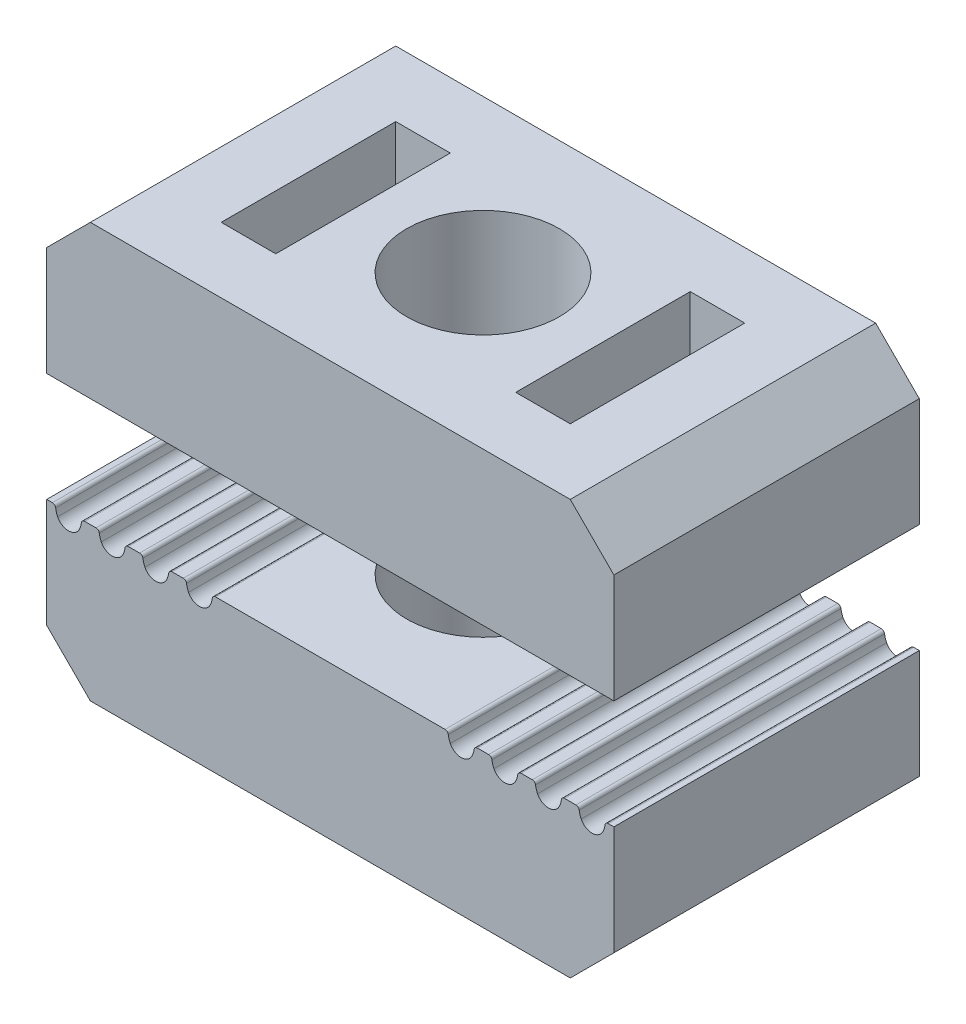
from build123d import *

# Parameters (mm, degrees)
SALIENTE_EXTRUIR1_DEPTH   = 14
SALIENTE_EXTRUIR1_2_DEPTH = 14
CROQUIS2_R                = 3.5
CORTAR_EXTRUIR1_DEPTH     = 27.944387171
CROQUIS3_W                = 2.5
CROQUIS3_H                = 8
CORTAR_EXTRUIR2_DEPTH     = 7
REDONDEO1_R               = 1


with BuildPart() as part:
    # Croquis1 → Saliente-Extruir1 (new body)
    with BuildSketch(Plane.XY):
        with BuildLine():
            Line((7.259824575, 7), (6.740175425, 7))
            ThreePointArc((6.740175425, 7), (6.641268354, 6.962771412), (6.591456891, 6.869565217))
            ThreePointArc((6.591456891, 6.869565217), (6.557611714, 6.711937846), (6.498876404, 6.561797753))
            ThreePointArc((6.498876404, 6.561797753), (6, 6.25), (5.501123596, 6.561797753))
            ThreePointArc((5.501123596, 6.561797753), (5.442388286, 6.711937846), (5.408543109, 6.869565217))
            ThreePointArc((5.408543109, 6.869565217), (5.358731646, 6.962771412), (5.259824575, 7))
            Line((5.259824575, 7), (5, 7))
            Line((5, 7), (-5, 7))
            Line((-5, 7), (-5.259824575, 7))
            ThreePointArc((-5.259824575, 7), (-5.358731646, 6.962771412), (-5.408543109, 6.869565217))
            ThreePointArc((-5.408543109, 6.869565217), (-5.442388286, 6.711937846), (-5.501123596, 6.561797753))
            ThreePointArc((-5.501123596, 6.561797753), (-6, 6.25), (-6.498876404, 6.561797753))
            ThreePointArc((-6.498876404, 6.561797753), (-6.557611714, 6.711937846), (-6.591456891, 6.869565217))
            ThreePointArc((-6.591456891, 6.869565217), (-6.641268354, 6.962771412), (-6.740175425, 7))
            Line((-6.740175425, 7), (-7.259824575, 7))
            ThreePointArc((-7.259824575, 7), (-7.358731646, 6.962771412), (-7.408543109, 6.869565217))
            ThreePointArc((-7.408543109, 6.869565217), (-7.442388286, 6.711937846), (-7.501123596, 6.561797753))
            ThreePointArc((-7.501123596, 6.561797753), (-8, 6.25), (-8.498876404, 6.561797753))
            ThreePointArc((-8.498876404, 6.561797753), (-8.557611714, 6.711937846), (-8.591456891, 6.869565217))
            ThreePointArc((-8.591456891, 6.869565217), (-8.641268354, 6.962771412), (-8.740175425, 7))
            Line((-8.740175425, 7), (-9, 7))
            Line((-9, 7), (-9.259824575, 7))
            ThreePointArc((-9.259824575, 7), (-9.358731646, 6.962771412), (-9.408543109, 6.869565217))
            ThreePointArc((-9.408543109, 6.869565217), (-9.442388286, 6.711937846), (-9.501123596, 6.561797753))
            ThreePointArc((-9.501123596, 6.561797753), (-10, 6.25), (-10.498876404, 6.561797753))
            ThreePointArc((-10.498876404, 6.561797753), (-10.557611714, 6.711937846), (-10.591456891, 6.869565217))
            ThreePointArc((-10.591456891, 6.869565217), (-10.641268354, 6.962771412), (-10.740175425, 7))
            Line((-10.740175425, 7), (-11.259824575, 7))
            ThreePointArc((-11.259824575, 7), (-11.358731646, 6.962771412), (-11.408543109, 6.869565217))
            ThreePointArc((-11.408543109, 6.869565217), (-11.442388286, 6.711937846), (-11.501123596, 6.561797753))
            ThreePointArc((-11.501123596, 6.561797753), (-12, 6.25), (-12.498876404, 6.561797753))
            ThreePointArc((-12.498876404, 6.561797753), (-12.557611714, 6.711937846), (-12.591456891, 6.869565217))
            ThreePointArc((-12.591456891, 6.869565217), (-12.641268354, 6.962771412), (-12.740175425, 7))
            Line((-12.740175425, 7), (-13, 7))
            Line((-13, 7), (-13, 2))
            Line((-13, 2), (-11, 0))
            Line((-11, 0), (11, 0))
            Line((11, 0), (13, 2))
            Line((13, 2), (13, 7))
            Line((13, 7), (12.740175425, 7))
            ThreePointArc((12.740175425, 7), (12.641268354, 6.962771412), (12.591456891, 6.869565217))
            ThreePointArc((12.591456891, 6.869565217), (12.557611714, 6.711937846), (12.498876404, 6.561797753))
            ThreePointArc((12.498876404, 6.561797753), (12, 6.25), (11.501123596, 6.561797753))
            ThreePointArc((11.501123596, 6.561797753), (11.442388286, 6.711937846), (11.408543109, 6.869565217))
            ThreePointArc((11.408543109, 6.869565217), (11.358731646, 6.962771412), (11.259824575, 7))
            Line((11.259824575, 7), (10.740175425, 7))
            ThreePointArc((10.740175425, 7), (10.641268354, 6.962771412), (10.591456891, 6.869565217))
            ThreePointArc((10.591456891, 6.869565217), (10.557611714, 6.711937846), (10.498876404, 6.561797753))
            ThreePointArc((10.498876404, 6.561797753), (10, 6.25), (9.501123596, 6.561797753))
            ThreePointArc((9.501123596, 6.561797753), (9.442388286, 6.711937846), (9.408543109, 6.869565217))
            ThreePointArc((9.408543109, 6.869565217), (9.358731646, 6.962771412), (9.259824575, 7))
            Line((9.259824575, 7), (9, 7))
            Line((9, 7), (8.740175425, 7))
            ThreePointArc((8.740175425, 7), (8.641268354, 6.962771412), (8.591456891, 6.869565217))
            ThreePointArc((8.591456891, 6.869565217), (8.557611714, 6.711937846), (8.498876404, 6.561797753))
            ThreePointArc((8.498876404, 6.561797753), (8, 6.25), (7.501123596, 6.561797753))
            ThreePointArc((7.501123596, 6.561797753), (7.442388286, 6.711937846), (7.408543109, 6.869565217))
            ThreePointArc((7.408543109, 6.869565217), (7.358731646, 6.962771412), (7.259824575, 7))
        make_face()
    extrude(amount=SALIENTE_EXTRUIR1_DEPTH)


with BuildPart() as body_2:
    # Croquis1 → Saliente-Extruir1 2 (new body)
    with BuildSketch(Plane.XY):
        Polygon((13, 17), (13, 12), (-13, 12), (-13, 17), (-11, 19), (11, 19), align=None)
    extrude(amount=SALIENTE_EXTRUIR1_2_DEPTH)


with BuildPart() as cortar_extruir1_tool:
    # Croquis2 → Cortar-Extruir1 (new, through all)
    with BuildSketch(Plane(origin=(0, 19, 0), x_dir=(1, 0, 0), z_dir=(0, 1, 0))):
        with Locations(Location((0, -7, 0), (0, 0, 180))):
            Circle(CROQUIS2_R)
    extrude(amount=-CORTAR_EXTRUIR1_DEPTH)


with BuildPart() as part_1:
    add(part.part)

    # Cortar-Extruir1: cut by cortar_extruir1_tool
    add(cortar_extruir1_tool.part, mode=Mode.SUBTRACT)


with BuildPart() as body_2_1:
    add(body_2.part)

    # Cortar-Extruir1: cut by cortar_extruir1_tool
    add(cortar_extruir1_tool.part, mode=Mode.SUBTRACT)

    # Croquis3 → Cortar-Extruir2 (cut)
    with BuildSketch(Plane(origin=(0, 19, 0), x_dir=(1, 0, 0), z_dir=(0, 1, 0))):
        with Locations((-6.75, -7)):
            Rectangle(CROQUIS3_W, CROQUIS3_H)
        with Locations((6.75, -7)):
            Rectangle(CROQUIS3_W, CROQUIS3_H)
    extrude(amount=-CORTAR_EXTRUIR2_DEPTH, mode=Mode.SUBTRACT)

    # Redondeo1
    redondeo1_edges = [body_2_1.edges().sort_by_distance(p)[0] for p in [
        (-8, 12, 7),
        (8, 12, 7),
    ]]
    fillet(redondeo1_edges, radius=REDONDEO1_R)


solid = Compound([part_1.part, body_2_1.part])
